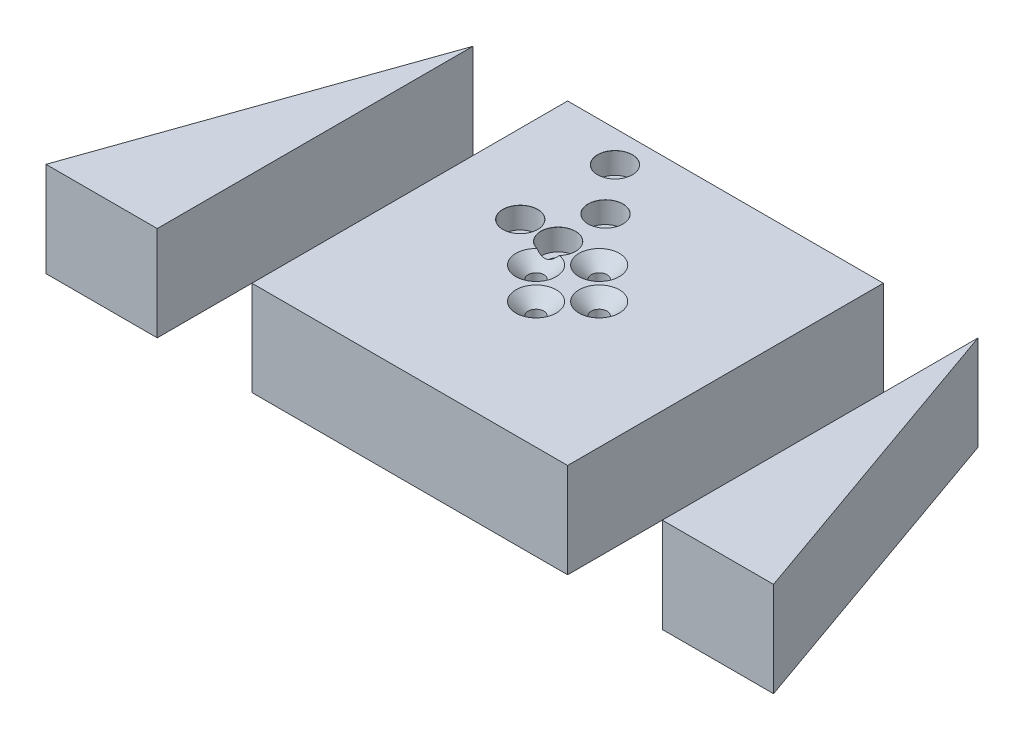
from build123d import *

# Parameters (mm, degrees)
SKETCH_1_W                  = 100
SKETCH_1_H                  = 100
EXTRUDE_1_DEPTH             = 30
EXTRUDE_1_2_DEPTH           = 30
PATTERN_LINEAR_1_COUNT      = 2
PATTERN_LINEAR_1_PITCH      = 12
PATTERN_LINEAR_1_COUNT_DIR2 = 3
PATTERN_LINEAR_1_PITCH_DIR2 = 15
PATTERN_CIRCULAR_1_COUNT    = 4


with BuildPart() as part:
    # 草图1 → 凸台-拉伸1 (new body)
    with BuildSketch(Plane(origin=(0, 0, 0), x_dir=(1, 0, 0), z_dir=(0, 1, 0))):
        Rectangle(SKETCH_1_W, SKETCH_1_H)
    extrude(amount=EXTRUDE_1_DEPTH)

    # 草图6 → M6 六角圆柱头螺钉的柱形沉头孔2 (revolve, cut)
    with BuildSketch(Plane(origin=(-25, 30, -10), x_dir=(0, 0, 1), z_dir=(1, 0, 0))):
        Polygon((0, 0), (0, 30), (3.3, 30), (3.3, 6.8), (5.5, 6.8), (5.5, 0.025), (5.525, 0), align=None)
    hole_wizard_m6_2 = revolve(axis=Axis((-25, 36.35, -10), (0, -1, 0)), mode=Mode.SUBTRACT)

    # 草图8 → M6 螺纹孔1 (revolve, cut)
    with BuildSketch(Plane(origin=(0, 30, -10), x_dir=(0, 0, 1), z_dir=(1, 0, 0))):
        Polygon((0, 0), (0, 30), (2.5, 30), (2.5, 3.9), (6.4, 0), align=None)
    hole_wizard_m6_1 = revolve(axis=Axis((0, 36.35, -10), (0, -1, 0)), mode=Mode.SUBTRACT)

    # 阵列(线性)1: Hole Wizard M6 _2 2 × 3, 2 skipped
    with Locations(*[(i * PATTERN_LINEAR_1_PITCH, 0, -j * PATTERN_LINEAR_1_PITCH_DIR2) for i in range(PATTERN_LINEAR_1_COUNT) for j in range(PATTERN_LINEAR_1_COUNT_DIR2) if (i, j) not in ((0, 0), (0, 1), (1, 2))]):
        add(hole_wizard_m6_2, mode=Mode.SUBTRACT)

    # 阵列(圆周)1: M6 螺纹孔1 ×4 about axis
    pattern_circular_1_axis = Axis((0, 0, 0), (0, 1, 0))
    for i in range(1, PATTERN_CIRCULAR_1_COUNT):
        add(hole_wizard_m6_1.rotate(pattern_circular_1_axis, i * 360 / PATTERN_CIRCULAR_1_COUNT), mode=Mode.SUBTRACT)


with BuildPart() as body_2:
    # 草图1 → Extrude 1 2 (new body)
    with BuildSketch(Plane(origin=(0, 0, 0), x_dir=(1, 0, 0), z_dir=(0, 1, 0))):
        Polygon((80, -50), (115.235457064, -50), (80, 50), align=None)
    extrude(amount=EXTRUDE_1_2_DEPTH)


with BuildPart() as body_3:
    # 镜向1: mirrored copy
    add(body_2.part.mirror(Plane(origin=(0, 0, 0), x_dir=(0, 0, 1), z_dir=(1, 0, 0))))


solid = Compound([part.part, body_2.part, body_3.part])
